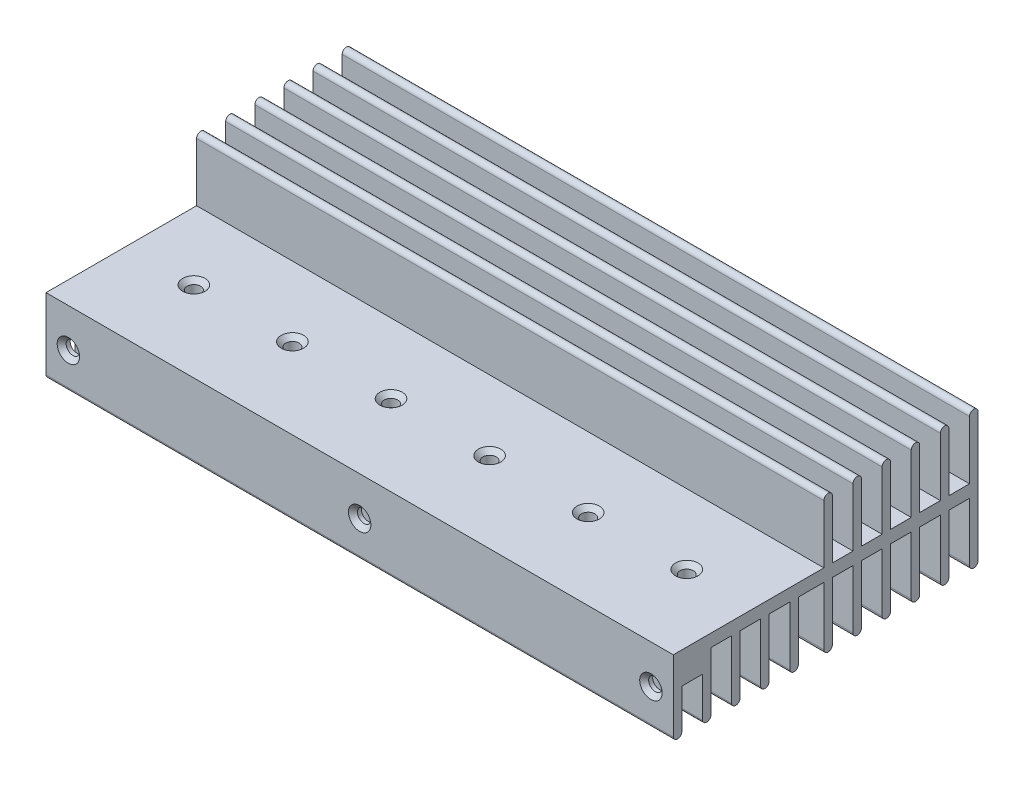
from build123d import *

# Parameters (mm, degrees)
BOSS_EXTRUDE1_DEPTH     = 70
CUT_EXTRUDE1_DEPTH      = 80.602528226
CUT_EXTRUDE1_DEPTH_BACK = 80.602528226
SKETCH2_R               = 1.5
CUT_EXTRUDE2_DEPTH      = 99.790801697
CUT_EXTRUDE2_DEPTH_BACK = 3
SKETCH3_R               = 1.5
CHAMFER1_SIZE           = 1


with BuildPart() as part:
    # Sketch1 → Boss-Extrude1 (new, symmetric)
    with BuildSketch(Plane(origin=(0, 0, 0), x_dir=(0, 0, -1), z_dir=(1, 0, 0))):
        with BuildLine():
            Line((34, 14.4), (34, -14.4))
            ThreePointArc((34, -14.4), (33.05, -15.35), (32.1, -14.4))
            Line((32.1, -14.4), (32.1, -1.4))
            Line((32.1, -1.4), (27.5, -1.4))
            Line((27.5, -1.4), (27.5, -14.4))
            ThreePointArc((27.5, -14.4), (26.55, -15.35), (25.6, -14.4))
            Line((25.6, -14.4), (25.6, -1.4))
            Line((25.6, -1.4), (21, -1.4))
            Line((21, -1.4), (21, -14.4))
            ThreePointArc((21, -14.4), (20.05, -15.35), (19.1, -14.4))
            Line((19.1, -14.4), (19.1, -1.4))
            Line((19.1, -1.4), (14.5, -1.4))
            Line((14.5, -1.4), (14.5, -14.4))
            ThreePointArc((14.5, -14.4), (13.55, -15.35), (12.6, -14.4))
            Line((12.6, -14.4), (12.6, -1.4))
            Line((12.6, -1.4), (8, -1.4))
            Line((8, -1.4), (8, -14.4))
            ThreePointArc((8, -14.4), (7.05, -15.35), (6.1, -14.4))
            Line((6.1, -14.4), (6.1, -1.4))
            Line((6.1, -1.4), (1.5, -1.4))
            Line((1.5, -1.4), (1.5, -14.4))
            ThreePointArc((1.5, -14.4), (0.55, -15.35), (-0.4, -14.4))
            Line((-0.4, -14.4), (-0.4, -1.4))
            Line((-0.4, -1.4), (-6.1, -1.4))
            Line((-6.1, -1.4), (-6.1, -14.492205882))
            ThreePointArc((-6.1, -14.492205882), (-7.05, -15.35), (-8, -14.492205882))
            Line((-8, -14.492205882), (-8, -1.4))
            Line((-8, -1.4), (-12.6, -1.4))
            Line((-12.6, -1.4), (-12.6, -14.492205882))
            ThreePointArc((-12.6, -14.492205882), (-13.55, -15.35), (-14.5, -14.492205882))
            Line((-14.5, -14.492205882), (-14.5, -1.4))
            Line((-14.5, -1.4), (-19.1, -1.4))
            Line((-19.1, -1.4), (-19.1, -14.492205882))
            ThreePointArc((-19.1, -14.492205882), (-20.05, -15.35), (-21, -14.492205882))
            Line((-21, -14.492205882), (-21, -1.4))
            Line((-21, -1.4), (-25.6, -1.4))
            Line((-25.6, -1.4), (-25.6, -14.492205882))
            ThreePointArc((-25.6, -14.492205882), (-26.55, -15.35), (-27.5, -14.492205882))
            Line((-27.5, -14.492205882), (-27.5, -5.6))
            Line((-27.5, -5.6), (-32.1, -5.6))
            Line((-32.1, -5.6), (-32.1, -14.492205882))
            ThreePointArc((-32.1, -14.492205882), (-33.05, -15.35), (-34, -14.492205882))
            Line((-34, -14.492205882), (-34, 1.4))
            Line((-34, 1.4), (-0.4, 1.4))
            Line((-0.4, 1.4), (-0.4, 14.4))
            ThreePointArc((-0.4, 14.4), (0.55, 15.35), (1.5, 14.4))
            Line((1.5, 14.4), (1.5, 1.4))
            Line((1.5, 1.4), (6.1, 1.4))
            Line((6.1, 1.4), (6.1, 14.4))
            ThreePointArc((6.1, 14.4), (7.05, 15.35), (8, 14.4))
            Line((8, 14.4), (8, 1.4))
            Line((8, 1.4), (12.6, 1.4))
            Line((12.6, 1.4), (12.6, 14.4))
            ThreePointArc((12.6, 14.4), (13.55, 15.35), (14.5, 14.4))
            Line((14.5, 14.4), (14.5, 1.4))
            Line((14.5, 1.4), (19.1, 1.4))
            Line((19.1, 1.4), (19.1, 14.4))
            ThreePointArc((19.1, 14.4), (20.05, 15.35), (21, 14.4))
            Line((21, 14.4), (21, 1.4))
            Line((21, 1.4), (25.6, 1.4))
            Line((25.6, 1.4), (25.6, 14.4))
            ThreePointArc((25.6, 14.4), (26.55, 15.35), (27.5, 14.4))
            Line((27.5, 14.4), (27.5, 1.4))
            Line((27.5, 1.4), (32.1, 1.4))
            Line((32.1, 1.4), (32.1, 14.4))
            ThreePointArc((32.1, 14.4), (33.05, 15.35), (34, 14.4))
        make_face()
    extrude(amount=BOSS_EXTRUDE1_DEPTH, both=True)

    # Sketch2 → Cut-Extrude1 (cut, two sides: drawn at the far end of the back side and taken through both)
    with BuildSketch(Plane(origin=(0, 1.4, 0), x_dir=(1, 0, 0), z_dir=(0, 1, 0)).offset(-CUT_EXTRUDE1_DEPTH_BACK)):
        with Locations(Location((55, -16, 0), (0, 0, 90))):
            Circle(SKETCH2_R)
        with Locations(Location((33, -16, 0), (0, 0, 90))):
            Circle(SKETCH2_R)
        with Locations(Location((11, -16, 0), (0, 0, 90))):
            Circle(SKETCH2_R)
        with Locations(Location((-55, -16, 0), (0, 0, 90))):
            Circle(SKETCH2_R)
        with Locations(Location((-33, -16, 0), (0, 0, 90))):
            Circle(SKETCH2_R)
        with Locations(Location((-11, -16, 0), (0, 0, 90))):
            Circle(SKETCH2_R)
    extrude(amount=CUT_EXTRUDE1_DEPTH + CUT_EXTRUDE1_DEPTH_BACK, mode=Mode.SUBTRACT)

    # Sketch3 → Cut-Extrude2 (cut, two sides: drawn at the far end of the back side and taken through both)
    with BuildSketch(Plane.XY.offset(34).offset(-CUT_EXTRUDE2_DEPTH_BACK)):
        with Locations(Location((65, -7.25, 0), (0, 0, 180))):
            Circle(SKETCH3_R)
        with Locations(Location((0, -7.25, 0), (0, 0, 180))):
            Circle(SKETCH3_R)
        with Locations(Location((-65, -7.25, 0), (0, 0, 180))):
            Circle(SKETCH3_R)
    extrude(amount=CUT_EXTRUDE2_DEPTH + CUT_EXTRUDE2_DEPTH_BACK, mode=Mode.SUBTRACT)

    # Chamfer1
    chamfer1_edges = [part.edges().sort_by_distance(p)[0] for p in [
        (55, 1.4, 17.5),
        (-11, 1.4, 17.5),
        (-33, 1.4, 17.5),
        (-55, 1.4, 17.5),
        (11, 1.4, 17.5),
        (33, 1.4, 17.5),
        (66.5, -7.25, 34),
        (1.5, -7.25, 34),
        (-63.5, -7.25, 34),
    ]]
    chamfer(chamfer1_edges, length=CHAMFER1_SIZE)


solid = part.part
